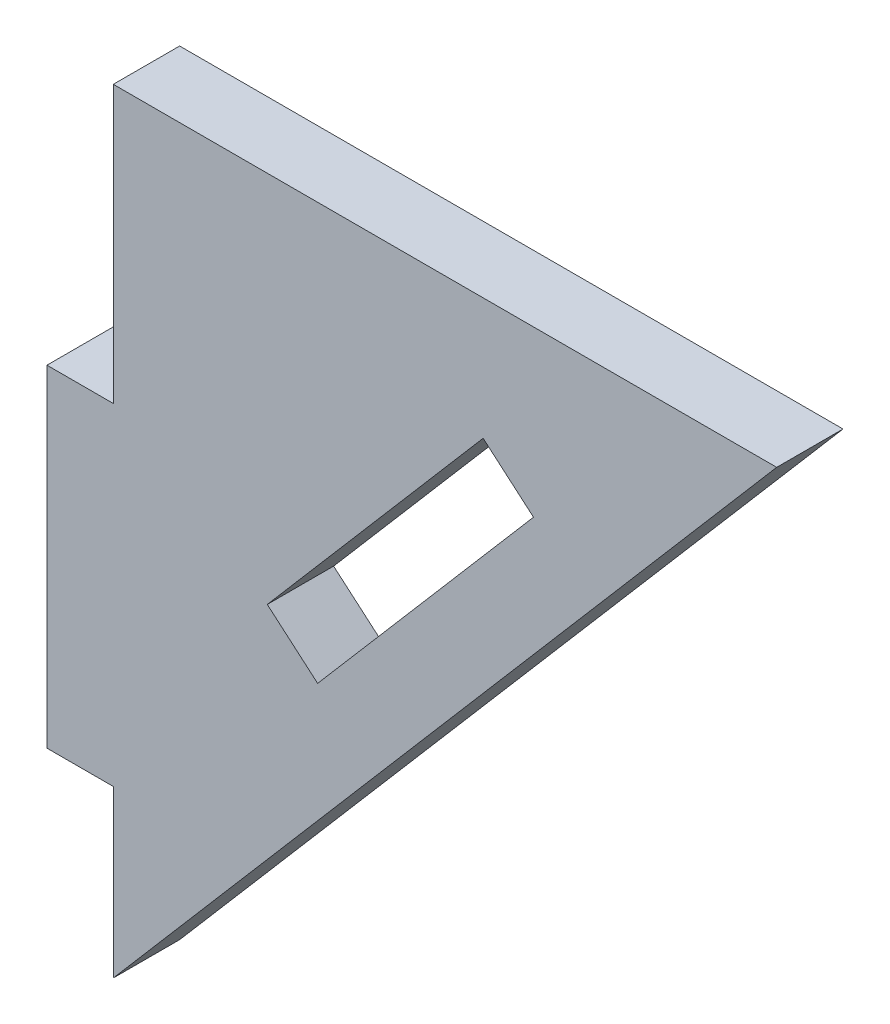
from build123d import *

# Parameters (mm, degrees)
BOSS_EXTRUDE1_DEPTH = 3


with BuildPart() as part:
    # Sketch1 → Boss-Extrude1 (new body)
    with BuildSketch(Plane.XY):
        Polygon((-15, -15), (15, 20), (-15, 20), (-15, 7.5), (-18, 7.5), (-18, -7.5), (-15, -7.5), align=None)
        Polygon((1.724708718, 14.5), (4.002478525, 12.54762588), (-5.759392077, 1.158776844), (-8.037161884, 3.111150965), align=None, mode=Mode.SUBTRACT)
    extrude(amount=BOSS_EXTRUDE1_DEPTH)


solid = part.part
